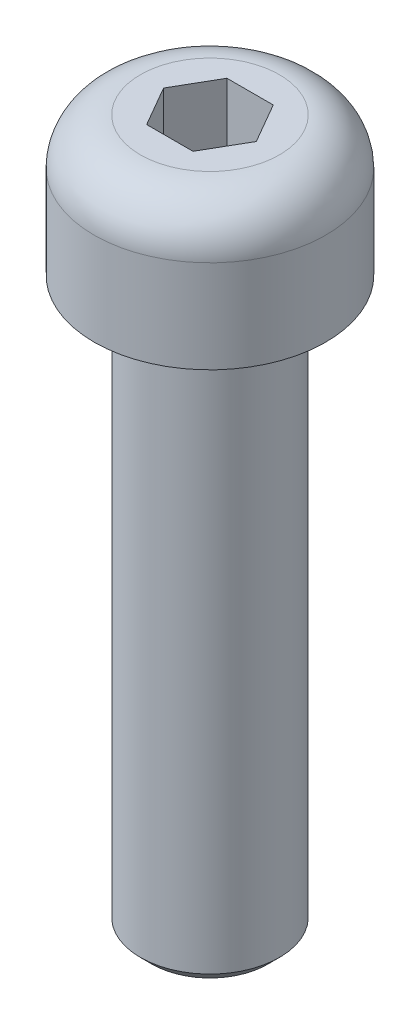
from build123d import *

# Parameters (mm, degrees)
SKETCH1_R           = 1.5
BOSS_EXTRUDE1_DEPTH = 12.25
SKETCH2_R           = 2.5
BOSS_EXTRUDE2_DEPTH = 3
FILLET1_R           = 1
CHAMFER1_SIZE       = 0.25
CUT_EXTRUDE1_DEPTH  = 2


with BuildPart() as part:
    # Sketch1 → Boss-Extrude1 (new body)
    with BuildSketch(Plane(origin=(0, 0, 0), x_dir=(1, 0, 0), z_dir=(0, 1, 0))):
        with Locations(Location((0, 0, 0), (0, 0, 270))):
            Circle(SKETCH1_R)
    extrude(amount=BOSS_EXTRUDE1_DEPTH)

    # Sketch2 → Boss-Extrude2 (add)
    with BuildSketch(Plane(origin=(0, 12.25, 0), x_dir=(1, 0, 0), z_dir=(0, 1, 0))):
        with Locations(Location((0, 0, 0), (0, 0, 270))):
            Circle(SKETCH2_R)
    extrude(amount=BOSS_EXTRUDE2_DEPTH)

    # Fillet1
    fillet1_edges = [part.edges().sort_by_distance(p)[0] for p in [
        (0, 15.25, -2.5),
    ]]
    fillet(fillet1_edges, radius=FILLET1_R)

    # Chamfer1
    chamfer1_edges = [part.edges().sort_by_distance(p)[0] for p in [
        (0, 0, -1.5),
    ]]
    chamfer(chamfer1_edges, length=CHAMFER1_SIZE)

    # Sketch3 → Cut-Extrude1 (cut)
    with BuildSketch(Plane(origin=(0, 15.25, 0), x_dir=(1, 0, 0), z_dir=(0, 1, 0))):
        Polygon((-1, 0), (-0.5, -0.866025404), (0.5, -0.866025404), (1, 0), (0.5, 0.866025404), (-0.5, 0.866025404), align=None)
    extrude(amount=-CUT_EXTRUDE1_DEPTH, mode=Mode.SUBTRACT)


solid = part.part
